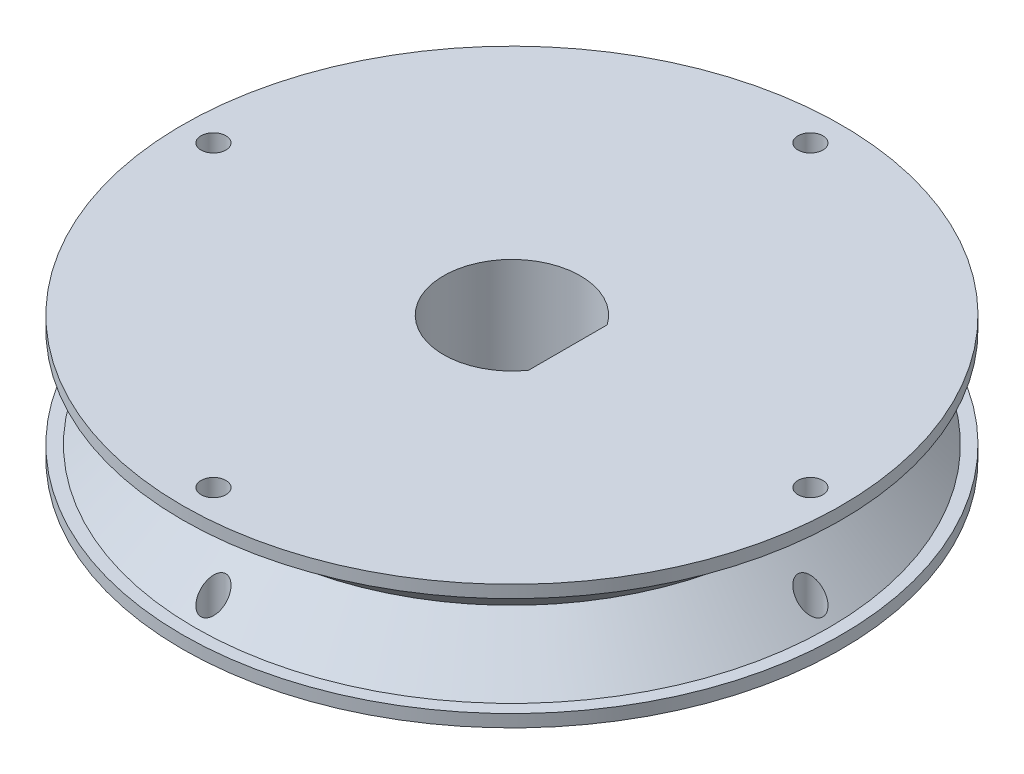
from build123d import *

# Parameters (mm, degrees)
SKETCH1_R           = 13.25
BOSS_EXTRUDE1_DEPTH = 5
SKETCH5_R           = 0.5
CUT_EXTRUDE1_DEPTH  = 5


with BuildPart() as part:
    # Sketch1 → Boss-Extrude1 (new body)
    with BuildSketch(Plane(origin=(0, 0, 0), x_dir=(1, 0, 0), z_dir=(0, 1, 0))):
        with Locations(Location((0, 0, 0), (0, 0, 270))):
            Circle(SKETCH1_R)
        with BuildLine():
            Line((2.25, 1.58113883), (2.25, -1.58113883))
            ThreePointArc((2.25, -1.58113883), (-2.75, 0), (2.25, 1.58113883))
        make_face(mode=Mode.SUBTRACT)
    extrude(amount=BOSS_EXTRUDE1_DEPTH)

    # Sketch4 → Cut-Revolve1 (revolve, cut)
    with BuildSketch(Plane.ZY):
        Polygon((12.75, 4.5), (10.75, 2.5), (12.75, 0.5), (13.25, 0.5), (13.25, 4.5), align=None)
    revolve(axis=Axis((0, 5, 0), (0, -1, 0)), mode=Mode.SUBTRACT)

    # Sketch5 → Cut-Extrude1 (cut)
    with BuildSketch(Plane(origin=(0, 5, 0), x_dir=(1, 0, 0), z_dir=(0, 1, 0))):
        with Locations(Location((-12, 0, 0), (0, 0, 270))):
            Circle(SKETCH5_R)
        with Locations(Location((12, 0, 0), (0, 0, 143.030391189))):
            Circle(SKETCH5_R)
        with Locations(Location((0, 12, 0), (0, 0, 270))):
            Circle(SKETCH5_R)
        with Locations(Location((0, -12, 0), (0, 0, 270.000003371))):
            Circle(SKETCH5_R)
    extrude(amount=-CUT_EXTRUDE1_DEPTH, mode=Mode.SUBTRACT)


solid = part.part
